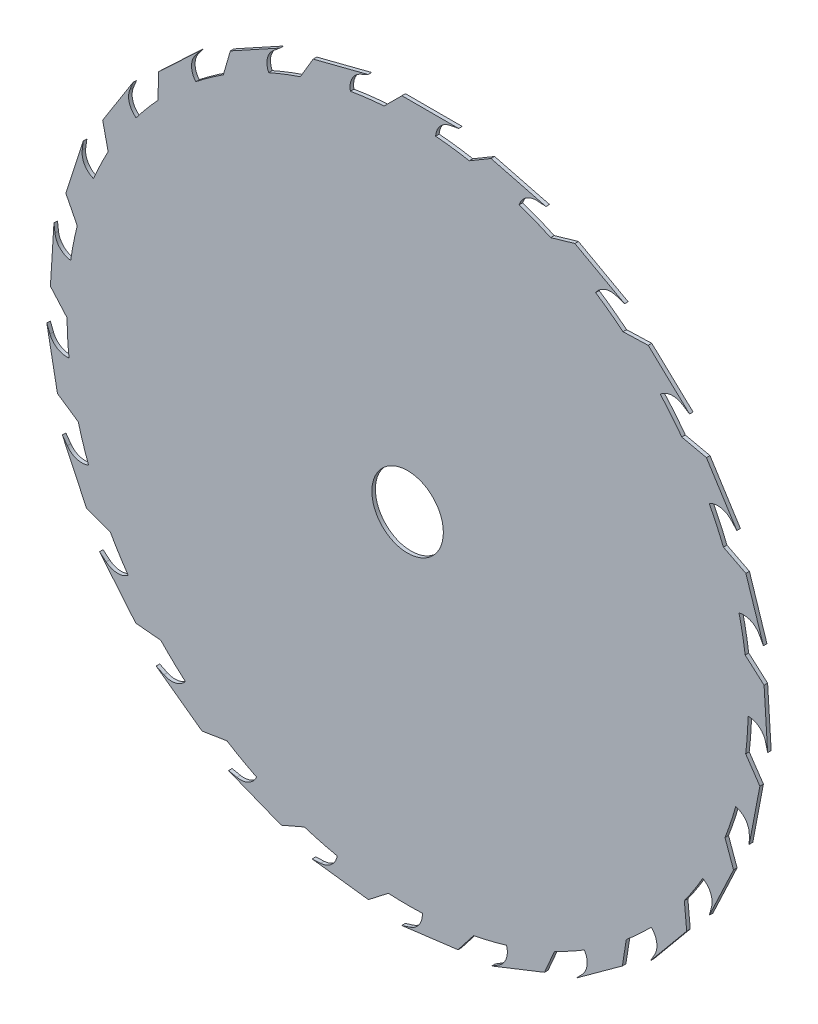
from build123d import *

# Parameters (mm, degrees)
SKETCH1_R           = 152.4
BOSS_EXTRUDE1_DEPTH = 1.5875
CUT_EXTRUDE1_REACH  = 217.532
SKETCH2_R           = 16.002
BOSS_EXTRUDE2_DEPTH = 1.5875
CIRPATTERN1_COUNT   = 25


with BuildPart() as part:
    # Sketch1 → Boss-Extrude1 (new body)
    with BuildSketch(Plane.XY):
        Circle(SKETCH1_R)
    extrude(amount=BOSS_EXTRUDE1_DEPTH)

    # Sketch2 → Cut-Extrude1 (cut, up to next)
    with BuildSketch(Plane.XY.offset(1.5875), mode=Mode.PRIVATE) as cut_extrude1_sk1:
        Circle(SKETCH2_R)
    cut_extrude1_tool1 = extrude(cut_extrude1_sk1.sketch, amount=-CUT_EXTRUDE1_REACH, mode=Mode.PRIVATE) & part.part
    add(cut_extrude1_tool1.solids().sort_by_distance((0, 0, 1.5875))[0], mode=Mode.SUBTRACT)

    # Sketch4 → Boss-Extrude2 (add)
    with BuildSketch(Plane.XY.offset(1.5875)):
        with BuildLine():
            Line((-12.7, 149.86), (-2.54, 160.02))
            Line((-2.54, 160.02), (22.86, 160.02))
            Line((22.86, 160.02), (19.112917361, 159.330455445))
            ThreePointArc((19.112917361, 159.330455445), (13.922314054, 155.938790933), (12.7, 149.86))
            Line((12.7, 149.86), (-12.7, 149.86))
        make_face()
    boss_extrude2 = extrude(amount=-BOSS_EXTRUDE2_DEPTH)

    # CirPattern1: Boss-Extrude2 ×25 about axis
    cirpattern1_axis = Axis((0, 0, 0), (0, 0, 1))
    for i in range(1, CIRPATTERN1_COUNT):
        add(boss_extrude2.rotate(cirpattern1_axis, i * 360 / CIRPATTERN1_COUNT))


solid = part.part
